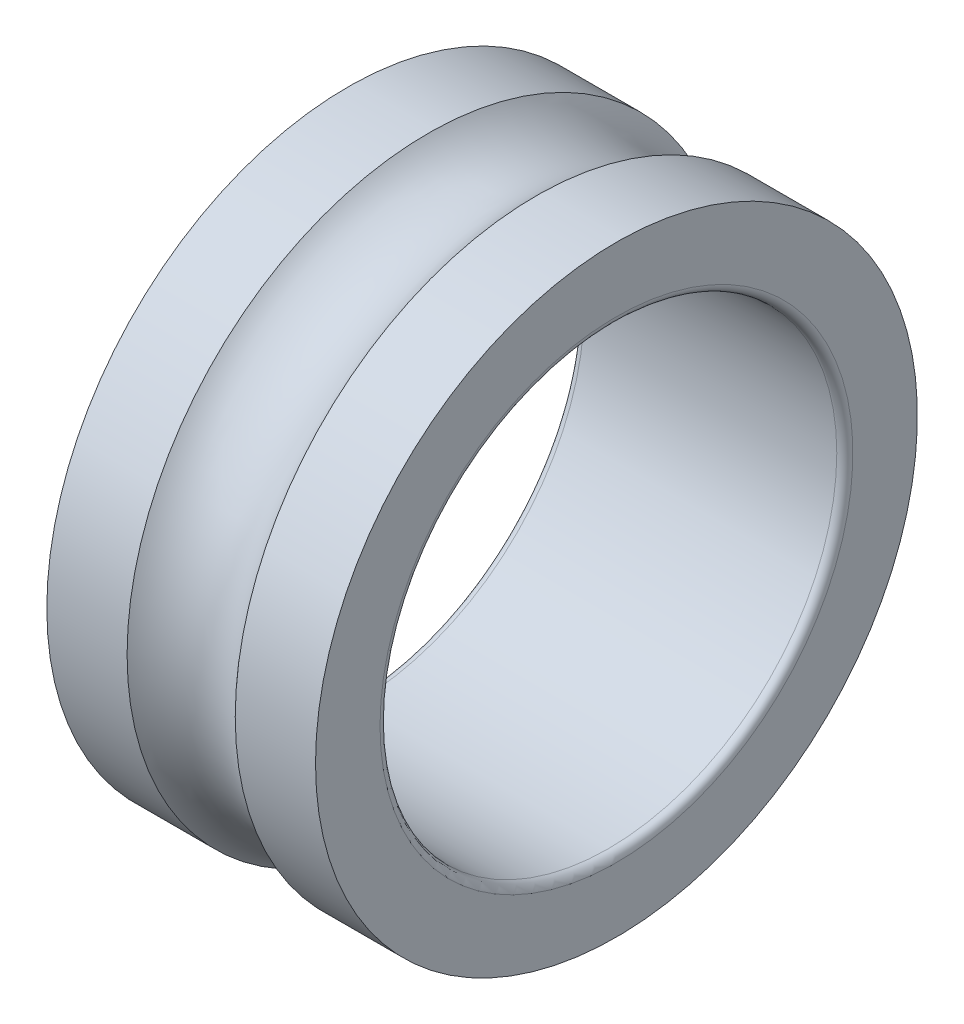
from build123d import *


with BuildPart() as part:
    # Esquisse1 → Base-Révolution (revolve)
    with BuildSketch(Plane(origin=(0, 0, 0), x_dir=(1, 0, 0), z_dir=(0, 1, 0))):
        with BuildLine():
            Line((0, 11.2), (0, 8.8))
            ThreePointArc((0, 8.8), (0.087867966, 8.587867966), (0.3, 8.5))
            Line((0.3, 8.5), (9.7, 8.5))
            ThreePointArc((9.7, 8.5), (9.912132034, 8.587867966), (10, 8.8))
            Line((10, 8.8), (10, 11.2))
            Line((10, 11.2), (7.01246118, 11.2))
            ThreePointArc((7.01246118, 11.2), (5, 10.3), (2.98753882, 11.2))
            Line((2.98753882, 11.2), (0, 11.2))
        make_face()
    revolve(axis=Axis((0, 0, 0), (1, 0, 0)))


solid = part.part
